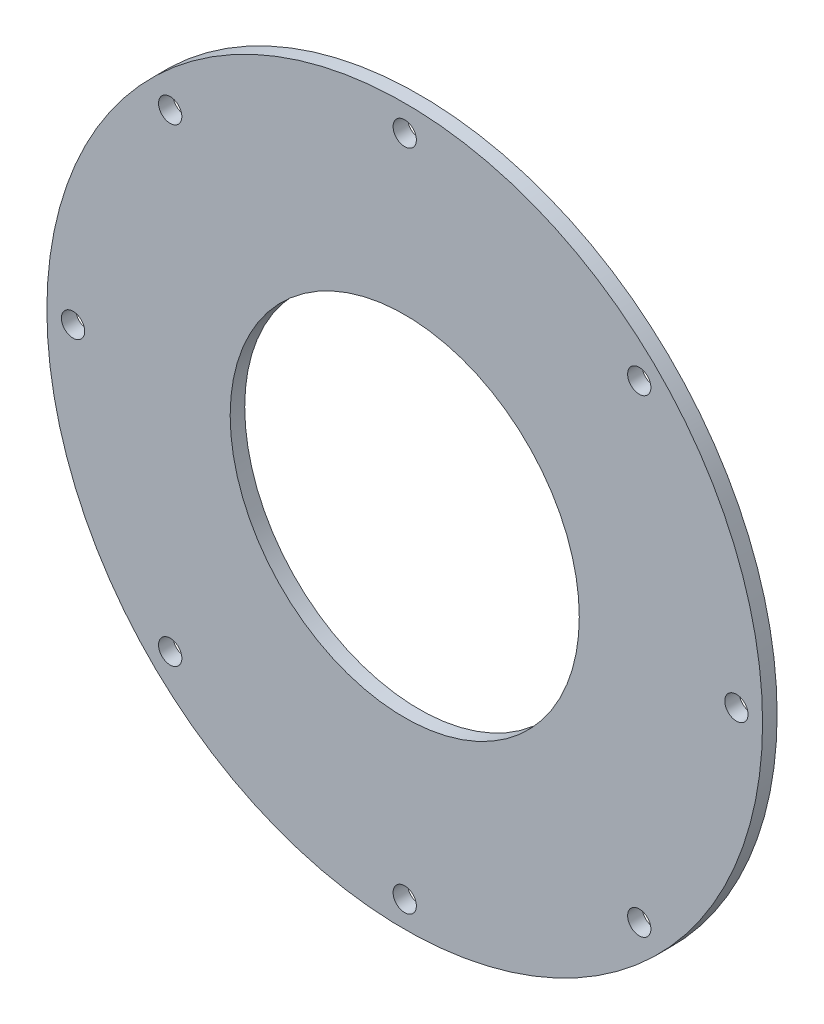
from build123d import *

# Parameters (mm, degrees)
SKETCH_1_R          = 61.5
SKETCH_1_R_2        = 2
SKETCH_1_R_3        = 2.6
SKETCH_1_R_4        = 15.5
EXTRUDE_1_DEPTH     = 2.5
SKETCH_2_R          = 30
CUT_EXTRUDE_1_DEPTH = 10


with BuildPart() as part:
    # 草图1 → 凸台-拉伸1 (new body)
    with BuildSketch(Plane.XY):
        Circle(SKETCH_1_R)
        with Locations((0, -57)):
            Circle(SKETCH_1_R_2, mode=Mode.SUBTRACT)
        with Locations((-40.305086528, -40.305086528)):
            Circle(SKETCH_1_R_2, mode=Mode.SUBTRACT)
        with Locations((-57, 0)):
            Circle(SKETCH_1_R_2, mode=Mode.SUBTRACT)
        with Locations((-40.305086528, 40.305086528)):
            Circle(SKETCH_1_R_2, mode=Mode.SUBTRACT)
        with Locations((0, -23.75)):
            Circle(SKETCH_1_R_3, mode=Mode.SUBTRACT)
        with Locations((-20.56810334, 11.875)):
            Circle(SKETCH_1_R_3, mode=Mode.SUBTRACT)
        with Locations((20.56810334, 11.875)):
            Circle(SKETCH_1_R_3, mode=Mode.SUBTRACT)
        with Locations((19.485571585, -11.25)):
            Circle(SKETCH_1_R_3, mode=Mode.SUBTRACT)
        with Locations((-19.485571585, -11.25)):
            Circle(SKETCH_1_R_3, mode=Mode.SUBTRACT)
        with Locations((0, 22.5)):
            Circle(SKETCH_1_R_3, mode=Mode.SUBTRACT)
        Circle(SKETCH_1_R_4, mode=Mode.SUBTRACT)
        with Locations((0, 57)):
            Circle(SKETCH_1_R_2, mode=Mode.SUBTRACT)
        with Locations((40.305086528, 40.305086528)):
            Circle(SKETCH_1_R_2, mode=Mode.SUBTRACT)
        with Locations((57, 0)):
            Circle(SKETCH_1_R_2, mode=Mode.SUBTRACT)
        with Locations((40.305086528, -40.305086528)):
            Circle(SKETCH_1_R_2, mode=Mode.SUBTRACT)
    extrude(amount=EXTRUDE_1_DEPTH)

    # 草图2 → 切除-拉伸1 (cut)
    with BuildSketch(Plane.XY.offset(2.5)):
        Circle(SKETCH_2_R)
    extrude(amount=-CUT_EXTRUDE_1_DEPTH, mode=Mode.SUBTRACT)


solid = part.part
